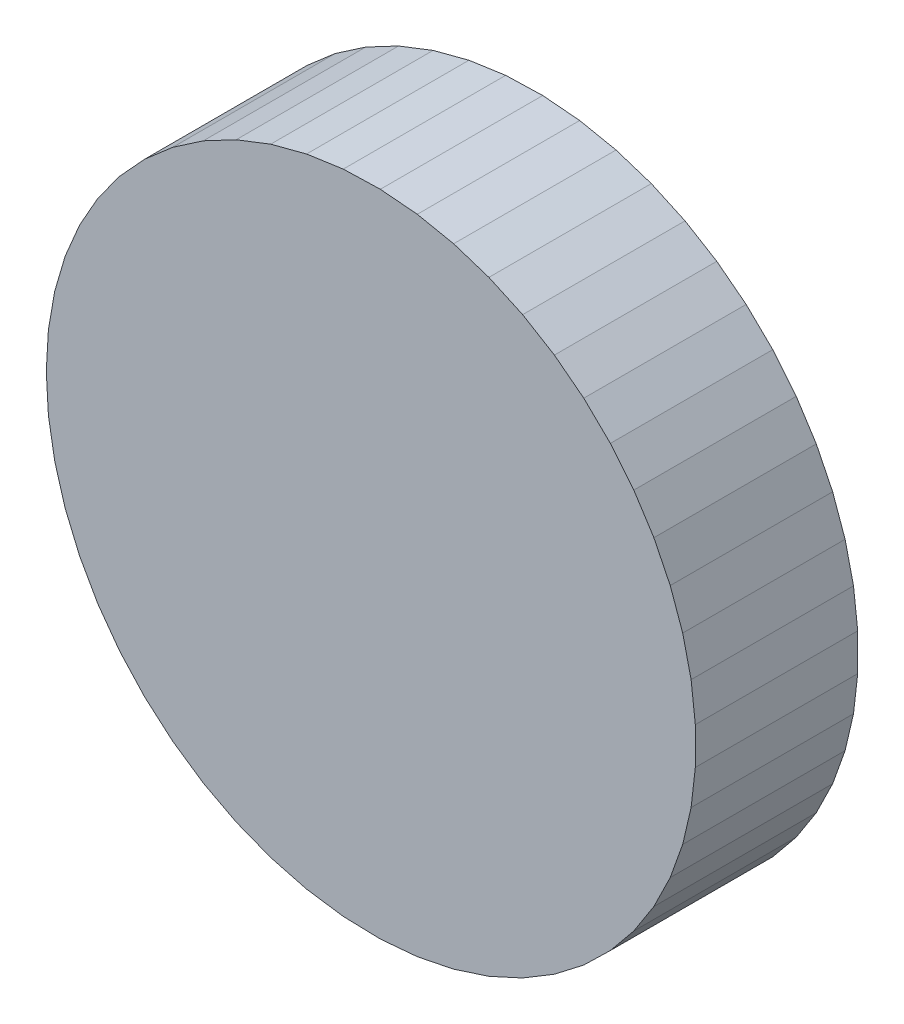
from build123d import *

# Parameters (mm, degrees)
TH_N_NGO_I_DEPTH      = 10
KHOANG_START          = 0.5
KHOANG_R_NG_K_N_DEPTH = 9


with BuildPart() as part:
    # Biên dạng ngoài theo phôi gốc → Thân ngoài (new body)
    with BuildSketch(Plane.XY):
        Polygon((-20, 0), (-19.869634628, -2.279828072), (-19.480237961, -4.52993536), (-18.83688736, -6.720988274), (-17.947967529, -8.824421883), (-16.825069428, -10.81281662), (-15.482831955, -12.66024971), (-13.938751221, -14.342636108), (-12.212957382, -15.83804512), (-10.327949524, -17.126981735), (-8.308300018, -18.192638397), (-6.180339813, -19.021131515), (-3.971809387, -19.601652145), (-1.711500168, -19.926635742), (0.571121037, -19.991844177), (2.846296787, -19.79642868), (5.084366798, -19.34293747), (7.25615406, -18.637279511), (9.333346367, -17.688657761), (11.288864136, -16.509437561), (13.097214699, -15.114992142), (14.734822273, -13.523497581), (16.180339813, -11.75570488), (17.414920807, -9.834658623), (18.422472, -7.785401821), (19.18985939, -5.634651184), (19.707077026, -3.410444021), (19.967382431, -1.141776204), (19.967382431, 1.141776204), (19.707077026, 3.410444021), (19.18985939, 5.634651184), (18.422472, 7.785401821), (17.414920807, 9.834658623), (16.180339813, 11.75570488), (14.734822273, 13.523497581), (13.097214699, 15.114992142), (11.288864136, 16.509437561), (9.333346367, 17.688657761), (7.25615406, 18.637279511), (5.084366798, 19.34293747), (2.846296787, 19.79642868), (0.571121037, 19.991844177), (-1.711500168, 19.926635742), (-3.971809387, 19.601652145), (-6.180339813, 19.021131515), (-8.308300018, 18.192638397), (-10.327949524, 17.126981735), (-12.212957382, 15.83804512), (-13.938751221, 14.342636108), (-15.482831955, 12.66024971), (-16.825069428, 10.81281662), (-17.947967529, 8.824421883), (-18.83688736, 6.720988274), (-19.480237961, 4.52993536), (-19.869634628, 2.279828072), align=None)
    extrude(amount=TH_N_NGO_I_DEPTH)

    # Biên dạng trong cách thành ngoài 0,3 mm → Khoang rỗng kín (cut)
    with BuildSketch(Plane.XY.offset(KHOANG_START)):
        Polygon((-19.57110405, -2.245574713), (-19.187557221, -4.461875439), (-18.553873062, -6.620008946), (-17.678308487, -8.691839218), (-16.572280884, -10.650359154), (-15.250209808, -12.470035553), (-13.729328155, -14.127144813), (-12.029463768, -15.600086212), (-10.172777176, -16.869657516), (-8.18347168, -17.919303894), (-6.087482929, -18.735347748), (-3.912134886, -19.30714798), (-1.68578577, -19.627248764), (0.562540114, -19.691476822), (2.8035326, -19.498996735), (5.007976532, -19.052318573), (7.147133827, -18.357263565), (9.193117142, -17.422893524), (11.119255066, -16.261390686), (12.900435448, -14.887896538), (14.513439179, -13.320313454), (15.937238693, -11.579081535), (17.153270721, -9.686898232), (18.145683289, -7.668429852), (18.901540756, -5.549993038), (19.410987854, -3.359203815), (19.667383194, -1.12462163), (19.667383194, 1.12462163), (19.410987854, 3.359203815), (18.901540756, 5.549993038), (18.145683289, 7.668429852), (17.153270721, 9.686898232), (15.937238693, 11.579081535), (14.513439179, 13.320313454), (12.900435448, 14.887896538), (11.119255066, 16.261390686), (9.193117142, 17.422893524), (7.147133827, 18.357263565), (5.007976532, 19.052318573), (2.8035326, 19.498996735), (0.562540114, 19.691476822), (-1.68578577, 19.627248764), (-3.912134886, 19.30714798), (-6.087482929, 18.735347748), (-8.18347168, 17.919303894), (-10.172777176, 16.869657516), (-12.029463768, 15.600086212), (-13.729328155, 14.127144813), (-15.250209808, 12.470035553), (-16.572280884, 10.650359154), (-17.678308487, 8.691839218), (-18.553873062, 6.620008946), (-19.187557221, 4.461875439), (-19.57110405, 2.245574713), (-19.699510574, 0), align=None)
    extrude(amount=KHOANG_R_NG_K_N_DEPTH, mode=Mode.SUBTRACT)


solid = part.part
